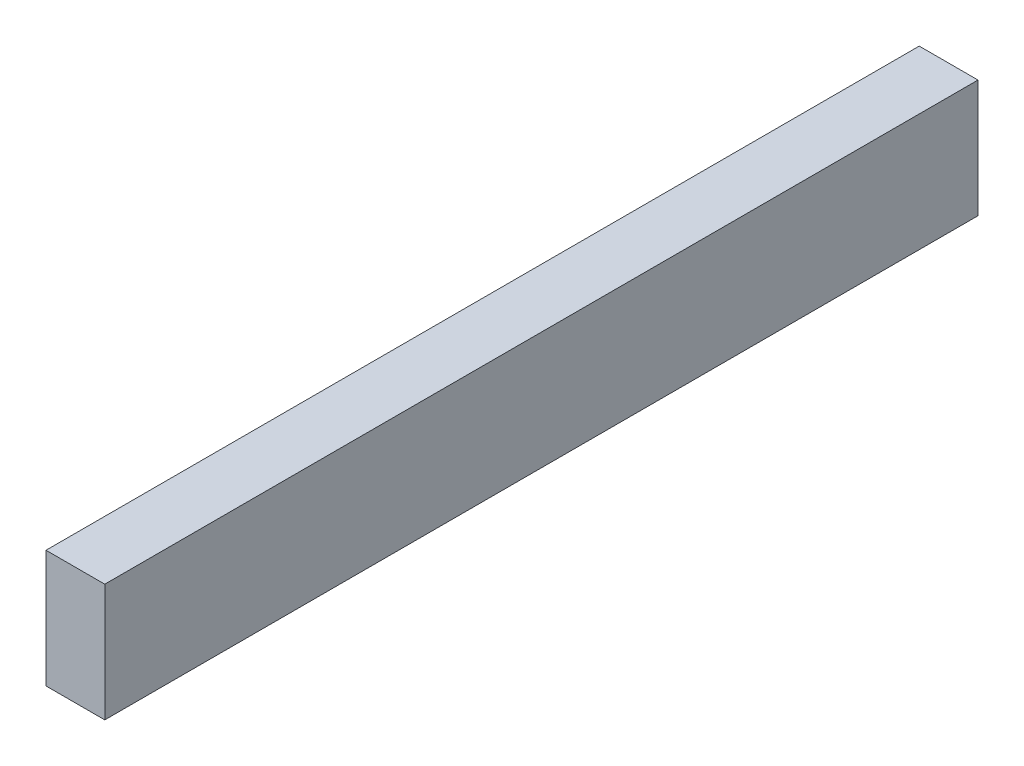
from build123d import *

# Parameters (mm, degrees)
SKETCH1_W           = 22.225
SKETCH1_H           = 44.45
BOSS_EXTRUDE1_DEPTH = 330.2


with BuildPart() as part:
    # Sketch1 → Boss-Extrude1 (new body)
    with BuildSketch(Plane.XY):
        with Locations((11.1125, 22.225)):
            Rectangle(SKETCH1_W, SKETCH1_H)
    extrude(amount=BOSS_EXTRUDE1_DEPTH)


solid = part.part
